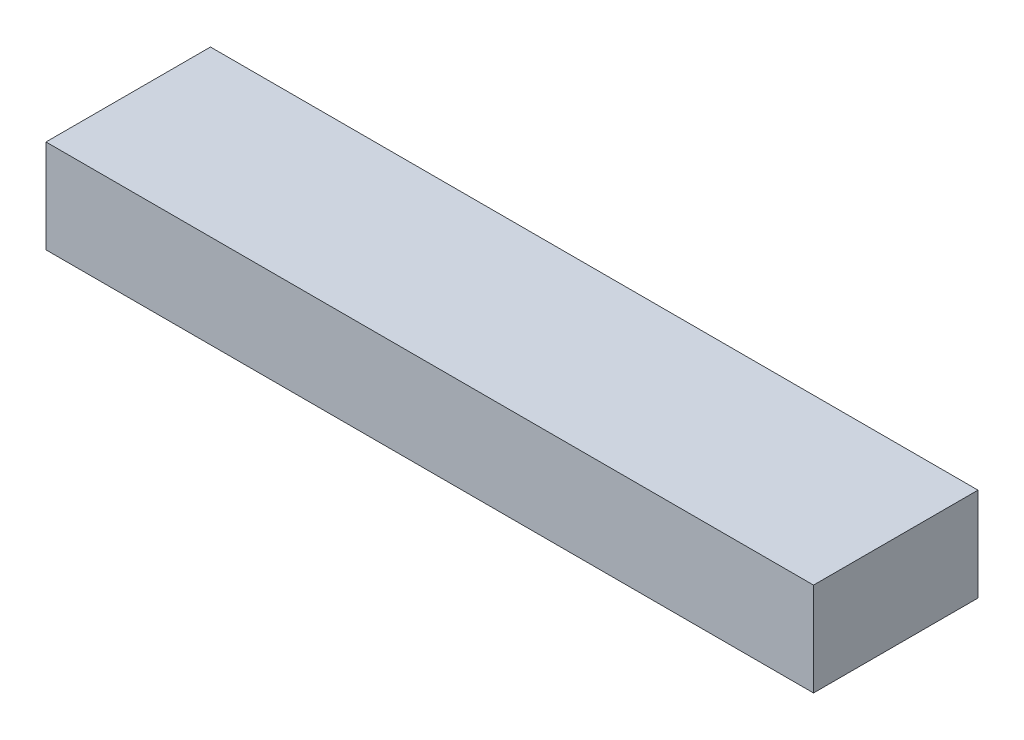
from build123d import *

# Parameters (mm, degrees)
SKETCH1_W           = 355.6
SKETCH1_H           = 43.299813287
BOSS_EXTRUDE1_DEPTH = 76.2


with BuildPart() as part:
    # Sketch1 → Boss-Extrude1 (new body)
    with BuildSketch(Plane.XY):
        with Locations((177.8, 21.649906643)):
            Rectangle(SKETCH1_W, SKETCH1_H)
    extrude(amount=BOSS_EXTRUDE1_DEPTH)


solid = part.part
